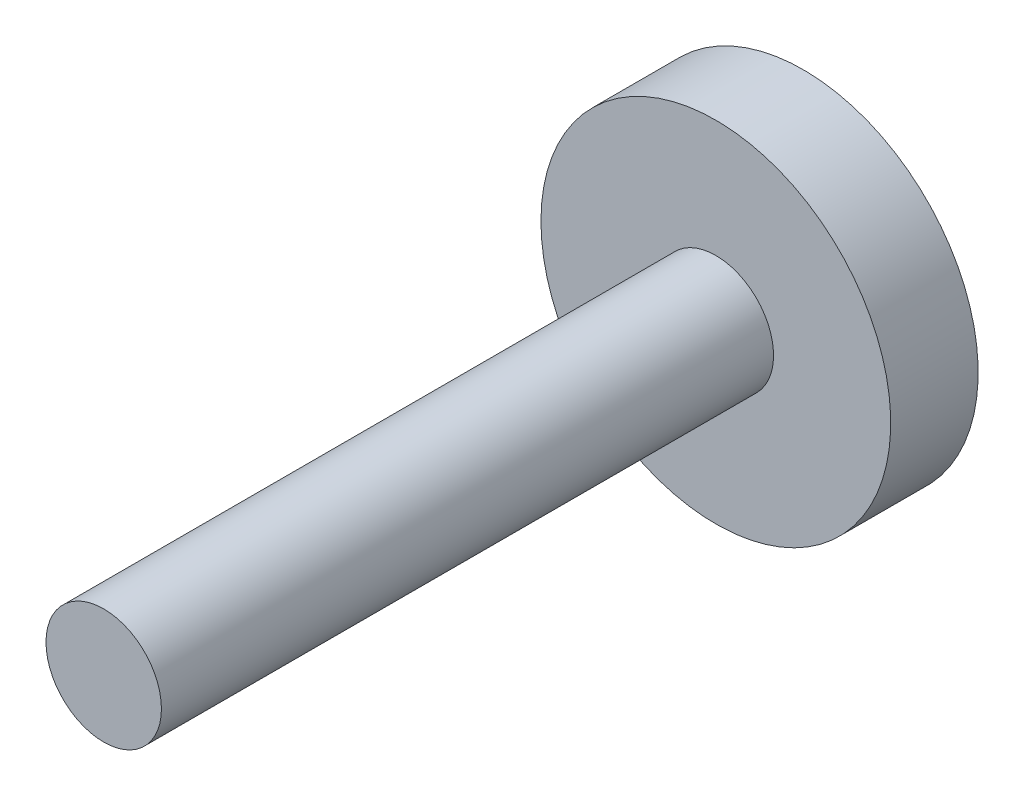
from build123d import *

# Parameters (mm, degrees)
SKETCH1_R           = 1.65
BOSS_EXTRUDE1_DEPTH = 20
SKETCH2_R           = 5
BOSS_EXTRUDE2_DEPTH = 2.5


with BuildPart() as part:
    # Sketch1 → Boss-Extrude1 (new body)
    with BuildSketch(Plane.XY):
        Circle(SKETCH1_R)
    extrude(amount=BOSS_EXTRUDE1_DEPTH)

    # Sketch2 → Boss-Extrude2 (add)
    with BuildSketch(Plane(origin=(0, 0, 0), x_dir=(-1, 0, 0), z_dir=(0, 0, -1))):
        Circle(SKETCH2_R)
    extrude(amount=-BOSS_EXTRUDE2_DEPTH)


solid = part.part
